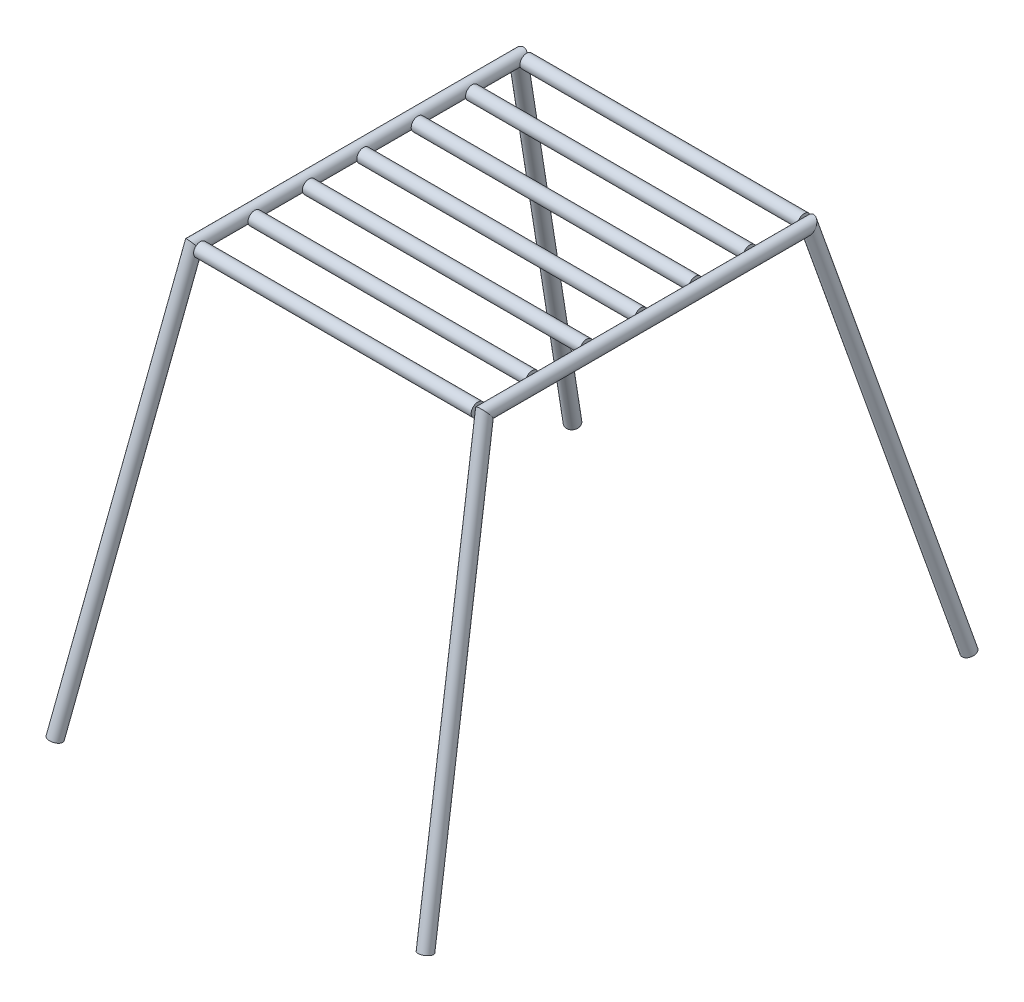
from build123d import *

# Parameters (mm, degrees)
SWEEP1_PROFILE_R = 25
SWEEP4_PROFILE_R = 25
LPATTERN1_COUNT  = 7
LPATTERN1_PITCH  = 205


with BuildPart() as part:
    # Sweep1: sweep along a curve in space
    with BuildLine() as sweep1_path:
        Line((698, 673.348237879, 1724.841016462), (548, 2173.348237879, 1352.615298417))
        Line((548, 2173.348237879, 1352.615298417), (548, 2173.348237879, 129.165241299))
        Line((548, 2173.348237879, 129.165241299), (747.126637555, 679.898456219, -274.544806265))
    # Sweep1 profile (on start of the path) → Sweep1 (sweep)
    with BuildSketch(Plane(origin=(698, 673.348237879, 1724.841016462), x_dir=(0, 0.24084577238006388, 0.9705634002612351), z_dir=(-0.09660241237961904, 0.9660241237961907, -0.23971934875232764))):
        Circle(SWEEP1_PROFILE_R)
    sweep(path=sweep1_path.line, transition=Transition.RIGHT)


with BuildPart() as body_2:
    # Mirror2: mirrored copy
    add(part.part.mirror(Plane(origin=(0, 0, 0), x_dir=(0, 0, 1), z_dir=(1, 0, 0))))


with BuildPart() as part_1:
    add(part.part)

    add(body_2.part)  # Sweep4 merges body 2
    # Sweep4: sweep along a curve in space
    with BuildLine() as sweep4_path:
        Line((523.124060053, 2170.860746823, 1352.61537863), (-523.124060053, 2170.860746823, 1352.61537863))
    # Sweep4 profile (on start of the path) → Sweep4 (sweep)
    with BuildSketch(Plane(origin=(523.124060053, 2170.860746823, 1352.61537863), x_dir=(0, -1, 0), z_dir=(-1, 0, 0))):
        Circle(SWEEP4_PROFILE_R)
    sweep4 = sweep(path=sweep4_path.line)

    # LPattern1: Sweep4 ×7
    with Locations(*[(0, 0, -i * LPATTERN1_PITCH) for i in range(1, LPATTERN1_COUNT)]):
        add(sweep4)


solid = part_1.part
